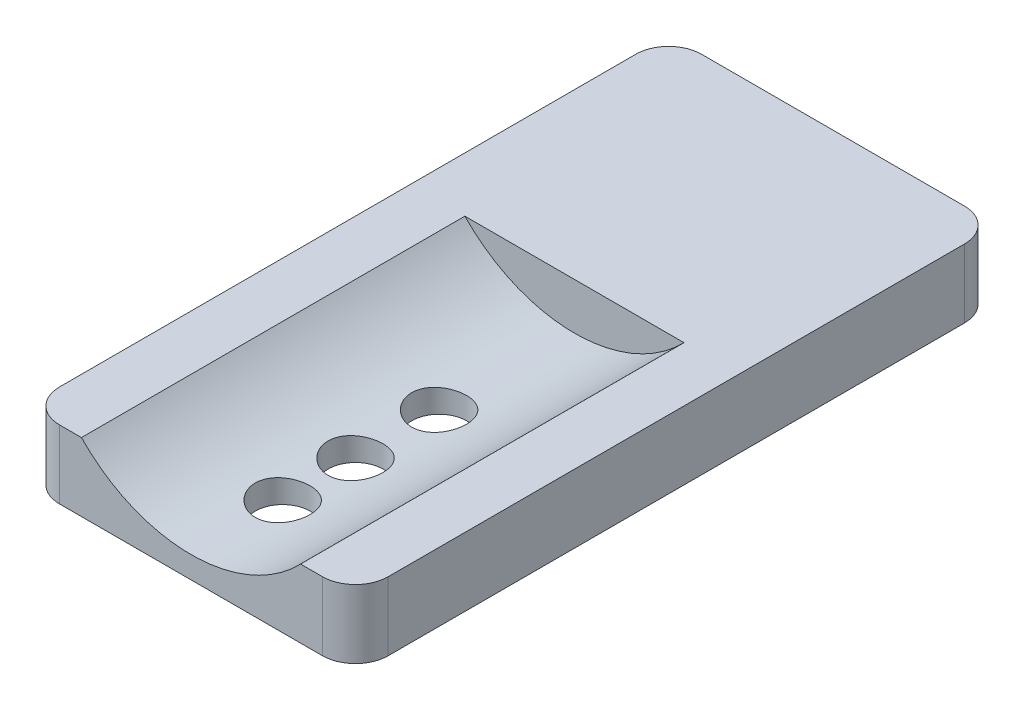
from build123d import *

# Parameters (mm, degrees)
SKETCH1_W               = 58.6
SKETCH1_H               = 6.25
BOSS_EXTRUDE1_DEPTH     = 30
CUT_EXTRUDE1_DEPTH      = 67.128832592
CUT_EXTRUDE1_DEPTH_BACK = 35
SKETCH4_R               = 2.5
SKETCH4_W               = 15.6
SKETCH4_H               = 10.5
CUT_EXTRUDE2_DEPTH      = 4
CUT_EXTRUDE3_DEPTH      = 9.5
SKETCH6_W               = 15.6
SKETCH6_H               = 1
SKETCH6_H_2             = 0.5
CUT_EXTRUDE4_DEPTH      = 4
FILLET1_R               = 3
SKETCH7_R               = 1.65
CUT_EXTRUDE5_DEPTH      = 3


with BuildPart() as part:
    # Sketch1 → Boss-Extrude1 (new body)
    with BuildSketch(Plane(origin=(0, 0, 0), x_dir=(0, 0, -1), z_dir=(1, 0, 0))):
        with Locations((29.3, 3.125)):
            Rectangle(SKETCH1_W, SKETCH1_H)
    extrude(amount=BOSS_EXTRUDE1_DEPTH)

    # Sketch2 → Cut-Extrude1 (cut, two sides: drawn at the far end of the back side and taken through both)
    with BuildSketch(Plane.XY.offset(-CUT_EXTRUDE1_DEPTH_BACK)):
        with BuildLine():
            Line((5, 6.25), (25, 6.25))
            ThreePointArc((25, 6.25), (15, 2), (5, 6.25))
        make_face()
    extrude(amount=CUT_EXTRUDE1_DEPTH + CUT_EXTRUDE1_DEPTH_BACK, mode=Mode.SUBTRACT)

    # Sketch4 → Cut-Extrude2 (cut)
    with BuildSketch(Plane.XZ):
        with Locations(Location((15, -8.37, 0), (0, 0, 270))):
            Circle(SKETCH4_R)
        with Locations(Location((15, -15.02, 0), (0, 0, 270))):
            Circle(SKETCH4_R)
        with Locations(Location((15, -22.65, 0), (0, 0, 270))):
            Circle(SKETCH4_R)
        with Locations((15, -43.35)):
            Rectangle(SKETCH4_W, SKETCH4_H)
    extrude(amount=-CUT_EXTRUDE2_DEPTH, mode=Mode.SUBTRACT)

    # Sketch5 → Cut-Extrude3 (cut)
    with BuildSketch(Plane(origin=(0, 0, -58.6), x_dir=(-1, 0, 0), z_dir=(0, 0, -1))):
        Polygon((-9.85, 0.95), (-20.15, 0.95), (-17.975, 3.125), (-20.15, 5.3), (-9.85, 5.3), align=None)
    extrude(amount=-CUT_EXTRUDE3_DEPTH, mode=Mode.SUBTRACT)

    # Sketch6 → Cut-Extrude4 (cut)
    with BuildSketch(Plane.XZ):
        with Locations((15, -37.6)):
            Rectangle(SKETCH6_W, SKETCH6_H)
        with Locations((15, -48.85)):
            Rectangle(SKETCH6_W, SKETCH6_H_2)
    extrude(amount=-CUT_EXTRUDE4_DEPTH, mode=Mode.SUBTRACT)

    # Fillet1
    fillet1_edges = [part.edges().sort_by_distance(p)[0] for p in [
        (30, 3.125, -58.6),
        (30, 3.125, 0),
        (0, 3.125, -58.6),
        (0, 3.125, 0),
    ]]
    fillet(fillet1_edges, radius=FILLET1_R)

    # Sketch7 → Cut-Extrude5 (cut)
    with BuildSketch(Plane.XZ):
        with Locations(Location((3, -55.6, 0), (0, 0, 270))):
            Circle(SKETCH7_R)
        with Locations(Location((27, -55.6, 0), (0, 0, 90))):
            Circle(SKETCH7_R)
        with Locations(Location((27, -3, 0), (0, 0, 270))):
            Circle(SKETCH7_R)
        with Locations(Location((3, -3, 0), (0, 0, 90))):
            Circle(SKETCH7_R)
    extrude(amount=-CUT_EXTRUDE5_DEPTH, mode=Mode.SUBTRACT)


solid = part.part
